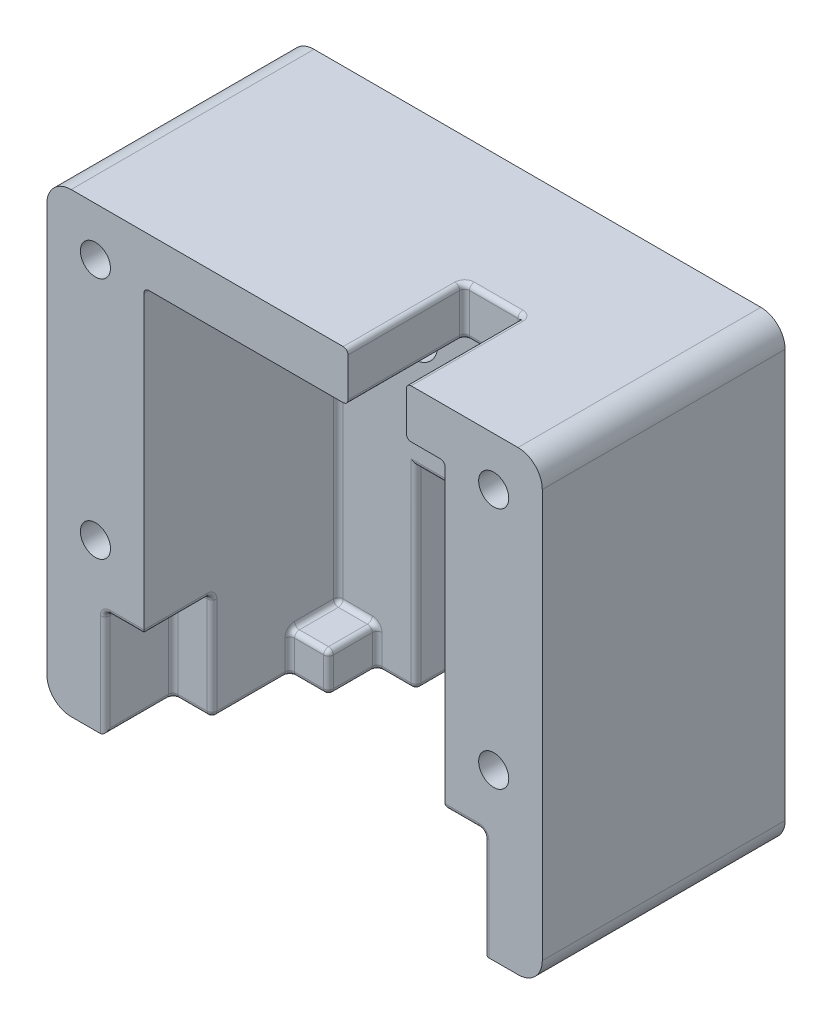
from build123d import *

# Parameters (mm, degrees)
SKETCH1_W           = 51
SKETCH1_H           = 47
BOSS_EXTRUDE1_DEPTH = 5
BOSS_EXTRUDE2_DEPTH = 20
SKETCH4_W           = 4
SKETCH4_H           = 4
BOSS_EXTRUDE3_DEPTH = 5
SKETCH5_W           = 4
SKETCH5_H           = 11
CUT_EXTRUDE1_DEPTH  = 7
SKETCH7_W           = 6
SKETCH7_H           = 5
CUT_EXTRUDE2_DEPTH  = 12
CUT_EXTRUDE3_DEPTH  = 4
SKETCH9_R           = 1.55
CUT_EXTRUDE4_DEPTH  = 10
SKETCH10_R          = 1.75
CUT_EXTRUDE5_DEPTH  = 73.18032973
SKETCH11_R          = 2.5
CUT_EXTRUDE6_DEPTH  = 2
FILLET1_R           = 0.5
FILLET2_R           = 2.5


with BuildPart() as part:
    # Sketch1 → Boss-Extrude1 (new body)
    with BuildSketch(Plane.XY):
        with Locations((25.5, 23.5)):
            Rectangle(SKETCH1_W, SKETCH1_H)
    extrude(amount=BOSS_EXTRUDE1_DEPTH)

    # Sketch2 → Boss-Extrude2 (add)
    with BuildSketch(Plane.XY.offset(5)):
        Polygon((0, 0), (0, 47), (51, 47), (51, 0), (41, 0), (41, 42), (10, 42), (10, 0), align=None)
    extrude(amount=BOSS_EXTRUDE2_DEPTH)

    # Sketch4 → Boss-Extrude3 (add)
    with BuildSketch(Plane.XY.offset(5)):
        with Locations((39, 2)):
            Rectangle(SKETCH4_W, SKETCH4_H)
        with Locations((12, 2)):
            Rectangle(SKETCH4_W, SKETCH4_H)
    extrude(amount=BOSS_EXTRUDE3_DEPTH)

    # Sketch5 → Cut-Extrude1 (cut)
    with BuildSketch(Plane.XY.offset(25)):
        with Locations((43, 5.5)):
            Rectangle(SKETCH5_W, SKETCH5_H)
        with Locations((8, 5.5)):
            Rectangle(SKETCH5_W, SKETCH5_H)
    extrude(amount=-CUT_EXTRUDE1_DEPTH, mode=Mode.SUBTRACT)

    # Sketch7 → Cut-Extrude2 (cut)
    with BuildSketch(Plane.XY.offset(25)):
        with Locations((34, 44.5)):
            Rectangle(SKETCH7_W, SKETCH7_H)
    extrude(amount=-CUT_EXTRUDE2_DEPTH, mode=Mode.SUBTRACT)

    # Sketch8 → Cut-Extrude3 (cut)
    with BuildSketch(Plane.XY.offset(5)):
        Polygon((25.5, 0), (33, 0), (33, 20), (18, 20), (18, 0), align=None)
    extrude(amount=-CUT_EXTRUDE3_DEPTH, mode=Mode.SUBTRACT)

    # Sketch9 → Cut-Extrude4 (cut)
    with BuildSketch(Plane.XY.offset(25)):
        with Locations((5, 17)):
            Circle(SKETCH9_R)
        with Locations((5, 42)):
            Circle(SKETCH9_R)
        with Locations((46, 42)):
            Circle(SKETCH9_R)
        with Locations((46, 17)):
            Circle(SKETCH9_R)
    extrude(amount=-CUT_EXTRUDE4_DEPTH, mode=Mode.SUBTRACT)

    # Sketch10 → Cut-Extrude5 (cut, through all)
    with BuildSketch(Plane.XY.offset(5)):
        with Locations((17.75, 32)):
            Circle(SKETCH10_R)
        with Locations((33.25, 32)):
            Circle(SKETCH10_R)
    extrude(amount=-CUT_EXTRUDE5_DEPTH, mode=Mode.SUBTRACT)

    # Sketch11 → Cut-Extrude6 (cut)
    with BuildSketch(Plane.XY.offset(5)):
        with Locations((17.75, 32)):
            Circle(SKETCH11_R)
        with Locations((33.25, 32)):
            Circle(SKETCH11_R)
    extrude(amount=-CUT_EXTRUDE6_DEPTH, mode=Mode.SUBTRACT)

    # Fillet1
    fillet1_edges = [part.edges().sort_by_distance(p)[0] for p in [
        (34, 47, 13),
        (31, 47, 19),
        (37, 44.5, 13),
        (37, 47, 19),
        (34, 42, 13),
        (37, 42, 19),
        (31, 44.5, 13),
        (31, 42, 19),
        (35, 0, 5),
        (18, 10, 1),
        (18, 0, 3),
        (25.5, 20, 1),
        (33, 10, 1),
        (25.5, 0, 1),
        (33, 0, 3),
        (18, 10, 5),
        (33, 10, 5),
        (25.5, 20, 5),
        (25.5, 42, 5),
        (10, 42, 15),
        (41, 23, 5),
        (41, 42, 15),
        (39, 4, 5),
        (41, 4, 7.5),
        (37, 2, 5),
        (37, 4, 7.5),
        (37, 0, 7.5),
        (41, 2, 10),
        (39, 4, 10),
        (37, 2, 10),
        (39, 0, 10),
        (10, 23, 5),
        (16, 0, 5),
        (10, 4, 7.5),
        (14, 2, 5),
        (14, 0, 7.5),
        (12, 4, 5),
        (14, 4, 7.5),
        (10, 2, 10),
        (12, 0, 10),
        (14, 2, 10),
        (12, 4, 10),
        (10, 0, 14),
        (41, 0, 14),
        (43, 0, 18),
        (45, 0, 21.5),
        (41, 5.5, 18),
        (43, 11, 18),
        (41, 11, 21.5),
        (45, 5.5, 18),
        (45, 11, 21.5),
        (45, 5.5, 25),
        (43, 11, 25),
        (8, 0, 18),
        (6, 5.5, 18),
        (6, 0, 21.5),
        (8, 11, 18),
        (6, 11, 21.5),
        (10, 5.5, 18),
        (10, 11, 21.5),
        (8, 11, 25),
        (6, 5.5, 25),
    ]]
    fillet(fillet1_edges, radius=FILLET1_R)

    # Fillet2
    fillet2_edges = [part.edges().sort_by_distance(p)[0] for p in [
        (0, 47, 12.5),
        (51, 47, 12.5),
        (51, 0, 12.5),
        (0, 0, 12.5),
    ]]
    fillet(fillet2_edges, radius=FILLET2_R)


solid = part.part
